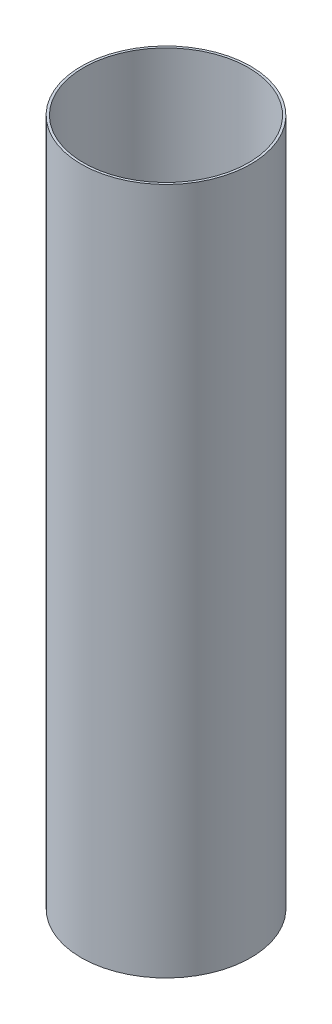
from build123d import *

# Parameters (mm, degrees)
SKETCH1_R           = 78.359
SKETCH1_R_2         = 76.2
BOSS_EXTRUDE1_DEPTH = 635


with BuildPart() as part:
    # Sketch1 → Boss-Extrude1 (new body)
    with BuildSketch(Plane(origin=(0, 0, 0), x_dir=(1, 0, 0), z_dir=(0, 1, 0))):
        with Locations(Location((0, 0, 0), (0, 0, 90))):
            Circle(SKETCH1_R)
        with Locations(Location((0, 0, 0), (0, 0, 90))):
            Circle(SKETCH1_R_2, mode=Mode.SUBTRACT)
    extrude(amount=BOSS_EXTRUDE1_DEPTH)


solid = part.part
